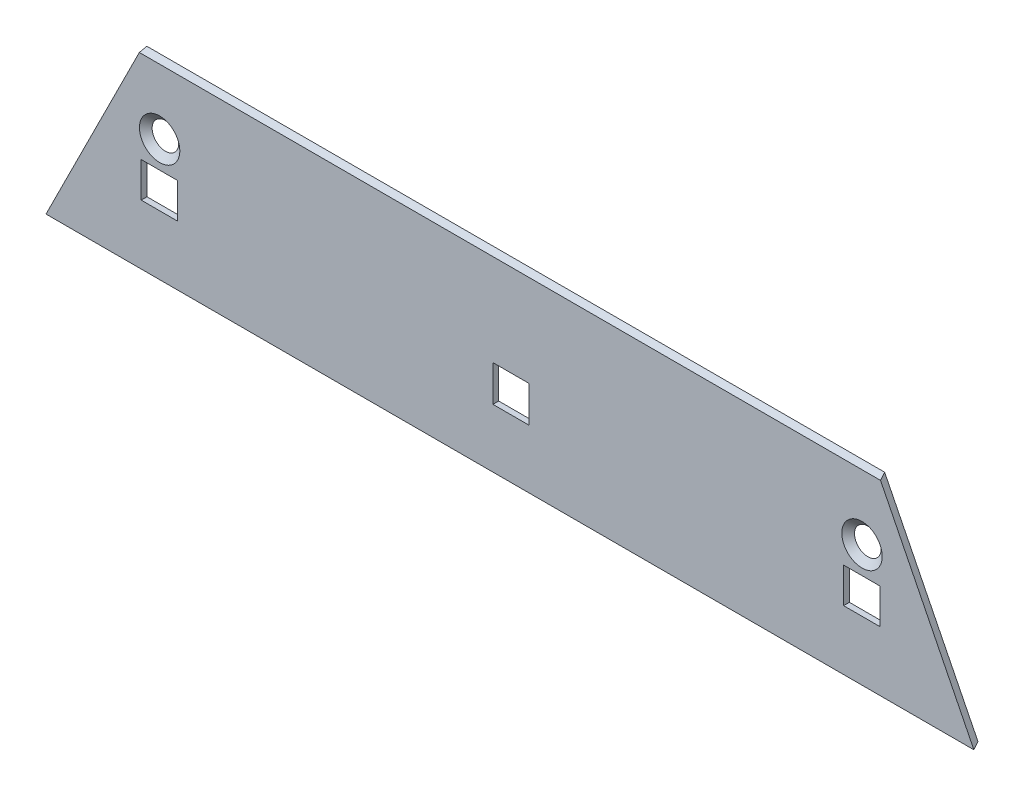
from build123d import *

# Parameters (mm, degrees)
BOSS_EXTRUDE2_DEPTH                       = 162.814
CUT_EXTRUDE1_DEPTH                        = 166.821138692
SKETCH6_W                                 = 6.35
SKETCH6_H                                 = 6.1722
SKETCH6_H_2                               = 6.35
CUT_EXTRUDE2_DEPTH                        = 166.821138692
CSK_FOR_6_FLAT_HEAD_MACHINE_SCREW_2_COUNT = 2
CSK_FOR_6_FLAT_HEAD_MACHINE_SCREW_2_PITCH = 123.248406325


with BuildPart() as part:
    # Sketch3 → Boss-Extrude2 (new body)
    with BuildSketch(Plane(origin=(0, 0, 0), x_dir=(0, 0, -1), z_dir=(1, 0, 0))):
        Polygon((-0.5715, 31.420044321), (-1.5875, 30.833456448), (-1.5875, -1.917455679), (-0.5715, -1.330867805), align=None)
    extrude(amount=BOSS_EXTRUDE2_DEPTH)

    # Sketch5 → Cut-Extrude1 (cut, through all)
    with BuildSketch(Plane.XY.offset(1.5875)):
        Polygon((0, -1.917455679), (16.672349491, 31.420044321), (0, 31.420044321), align=None)
        Polygon((162.814, -1.917455679), (146.141650509, 31.420044321), (162.814, 31.420044321), align=None)
    extrude(amount=-CUT_EXTRUDE1_DEPTH, mode=Mode.SUBTRACT)

    # Sketch6 → Cut-Extrude2 (cut, through all)
    with BuildSketch(Plane.XY.offset(1.5875)):
        with Locations((19.880593675, 11.641857216)):
            Rectangle(SKETCH6_W, SKETCH6_H)
        with Locations((143.129, 11.641857216)):
            Rectangle(SKETCH6_W, SKETCH6_H)
        with Locations((81.593696837, 11.552957216)):
            Rectangle(SKETCH6_W, SKETCH6_H_2)
    extrude(amount=-CUT_EXTRUDE2_DEPTH, mode=Mode.SUBTRACT)

    # Sketch7 → CSK for #6 Flat Head Machine Screw (100)1 (revolve, cut)
    with BuildSketch(Plane(origin=(19.939, 19.426957216, 1.5875), x_dir=(0, -1, 0), z_dir=(1, 0, 0))):
        Polygon((0, 0), (0, 1.016), (1.89865, 1.016), (1.89865, 1.380025208), (3.5433, 0), align=None)
    csk_for_6_flat_head_machine_screw_100 = revolve(axis=Axis((19.939, 19.426957216, 7.9375), (0, 0, -1)), mode=Mode.SUBTRACT)

    # CSK for _6 Flat Head Machine Screw _ 2: CSK for #6 Flat Head Machine Screw (100)1 ×2
    with Locations(*[(i * CSK_FOR_6_FLAT_HEAD_MACHINE_SCREW_2_PITCH, 0, 0) for i in range(1, CSK_FOR_6_FLAT_HEAD_MACHINE_SCREW_2_COUNT)]):
        add(csk_for_6_flat_head_machine_screw_100, mode=Mode.SUBTRACT)


solid = part.part
